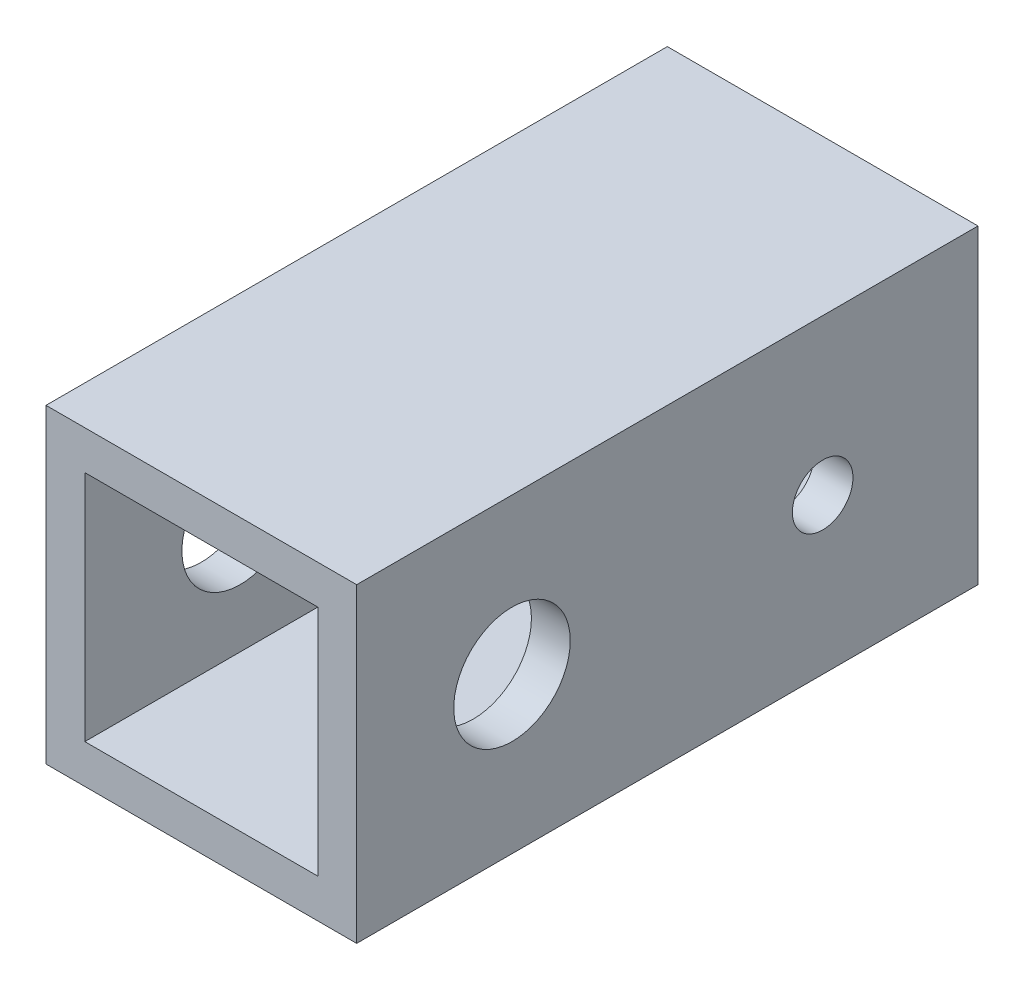
from build123d import *

# Parameters (mm, degrees)
SKETCH1_W           = 25.4
SKETCH1_H           = 25.4
SKETCH1_W_2         = 19.05
SKETCH1_H_2         = 19.05
EXTRUDE_THIN1_DEPTH = 50.8
SKETCH2_R           = 4.7625
SKETCH2_R_2         = 2.4765
CUT_EXTRUDE1_DEPTH  = 59.198711326


with BuildPart() as part:
    # Sketch1 → Extrude-Thin1 (new body)
    with BuildSketch(Plane.XY):
        Rectangle(SKETCH1_W, SKETCH1_H)
        Rectangle(SKETCH1_W_2, SKETCH1_H_2, mode=Mode.SUBTRACT)
    extrude(amount=EXTRUDE_THIN1_DEPTH)

    # Sketch2 → Cut-Extrude1 (cut, through all)
    with BuildSketch(Plane(origin=(12.7, 0, 0), x_dir=(0, 0, -1), z_dir=(1, 0, 0))):
        with Locations((-38.1, 0)):
            Circle(SKETCH2_R)
        with Locations((-12.7, 0)):
            Circle(SKETCH2_R_2)
    extrude(amount=-CUT_EXTRUDE1_DEPTH, mode=Mode.SUBTRACT)


solid = part.part
